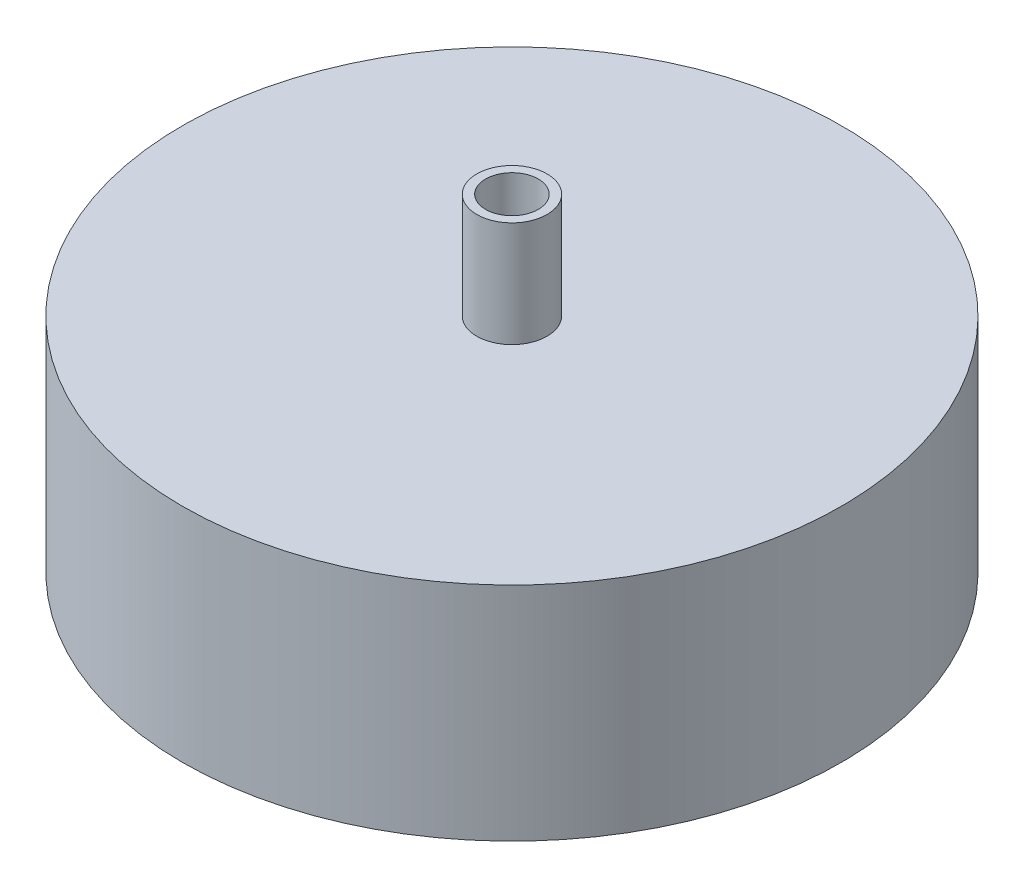
from build123d import *

# Parameters (mm, degrees)
SKETCH_1_R          = 37.5
EXTRUDE_1_DEPTH     = 25.24
SKETCH_2_R          = 4
SKETCH_2_R_2        = 3
EXTRUDE_2_DEPTH     = 12
CUT_EXTRUDE_1_REACH = 60.733
SKETCH_3_R          = 3


with BuildPart() as part:
    # 草图1 → 凸台-拉伸1 (new body)
    with BuildSketch(Plane(origin=(0, 0, 0), x_dir=(1, 0, 0), z_dir=(0, 1, 0))):
        with Locations(Location((0, 0, 0), (0, 0, 270))):
            Circle(SKETCH_1_R)
    extrude(amount=EXTRUDE_1_DEPTH)

    # 草图2 → 凸台-拉伸2 (add)
    with BuildSketch(Plane(origin=(0, 25.24, 0), x_dir=(1, 0, 0), z_dir=(0, 1, 0))):
        with Locations(Location((0, 0, 0), (0, 0, 270))):
            Circle(SKETCH_2_R)
        with Locations(Location((0, 0, 0), (0, 0, 270))):
            Circle(SKETCH_2_R_2, mode=Mode.SUBTRACT)
    extrude(amount=EXTRUDE_2_DEPTH)

    # 草图3 → 切除-拉伸1 (cut, up to next)
    with BuildSketch(Plane(origin=(0, 25.24, 0), x_dir=(1, 0, 0), z_dir=(0, 1, 0)), mode=Mode.PRIVATE) as cut_extrude_1_sk1:
        with Locations(Location((0, 0, 0), (0, 0, 270))):
            Circle(SKETCH_3_R)
    cut_extrude_1_tool1 = extrude(cut_extrude_1_sk1.sketch, amount=-CUT_EXTRUDE_1_REACH, mode=Mode.PRIVATE) & part.part
    add(cut_extrude_1_tool1.solids().sort_by_distance((0, 25.24, 0))[0], mode=Mode.SUBTRACT)


solid = part.part
